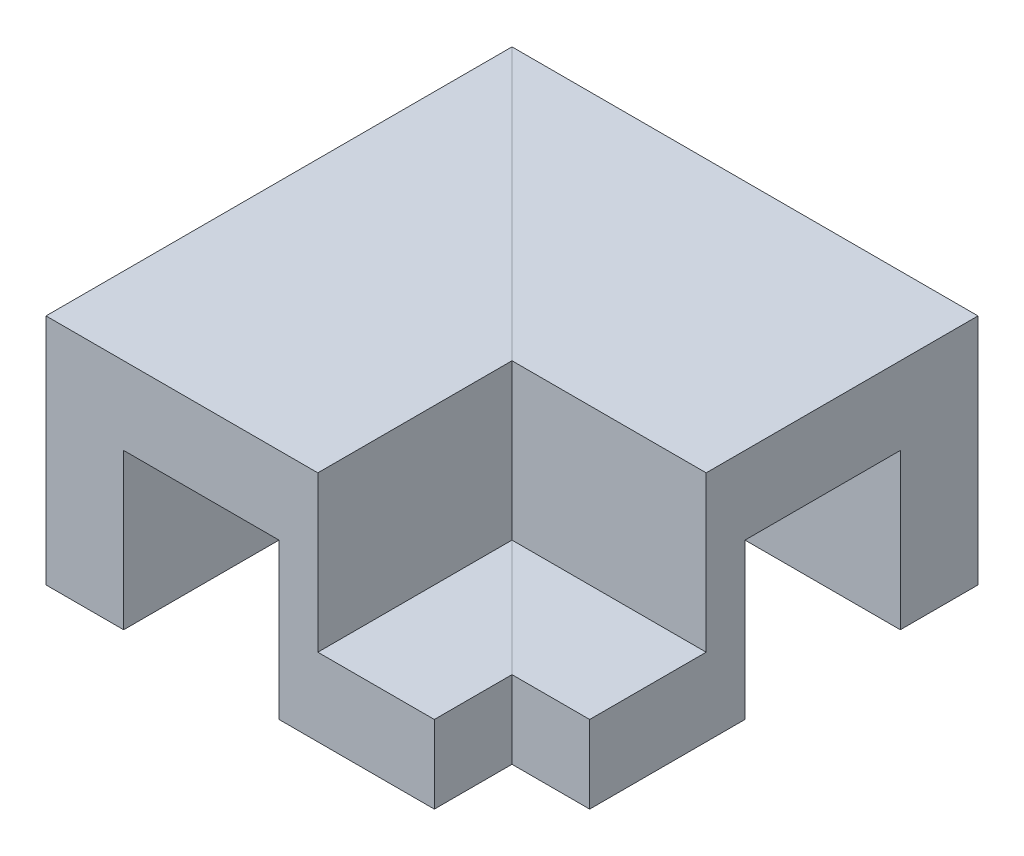
from build123d import *


with BuildPart() as part:
    # Sweep1: sweep along a path in Sketch2
    with BuildLine(Plane(origin=(0, 0, 0), x_dir=(1, 0, 0), z_dir=(0, 1, 0))) as sweep1_path:
        Line((19.05, 0), (0, 0))
        Line((0, 0), (0, -19.05))
    # Sketch3 → Sweep1 (sweep)
    with BuildSketch(Plane.XY.offset(19.05)):
        Polygon((0, 0), (12.7, 0), (12.7, 6.35), (3.175, 6.35), (3.175, 19.05), (-19.05, 19.05), (-19.05, 0), (-12.7, 0), (-12.7, 12.7), (0, 12.7), align=None)
    sweep(path=sweep1_path.line, transition=Transition.RIGHT)


solid = part.part
